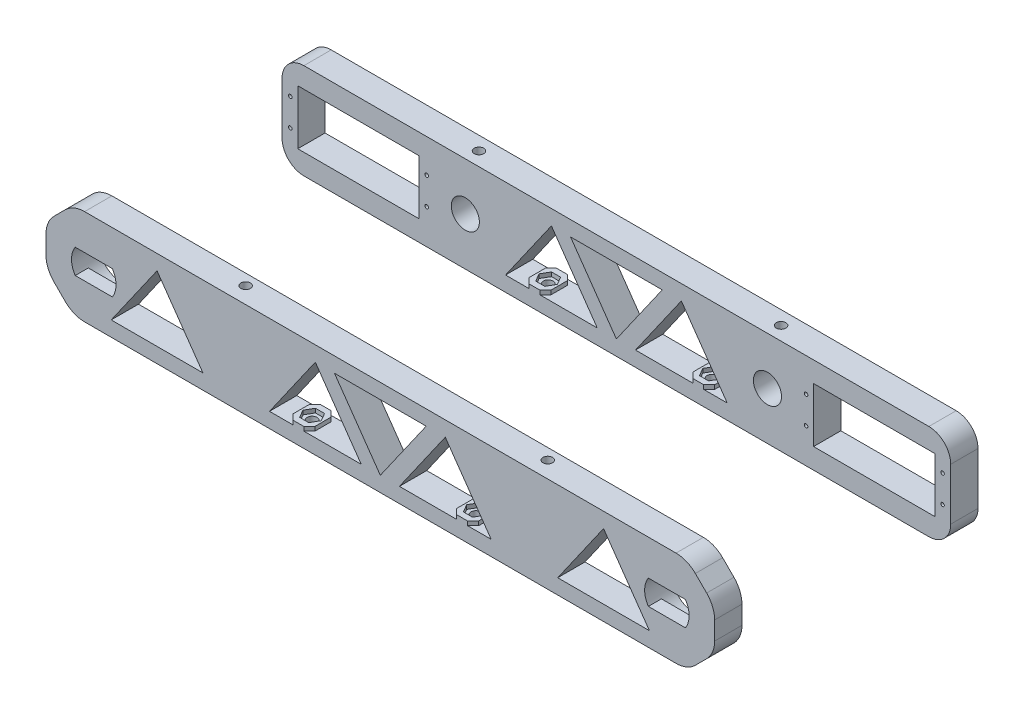
from build123d import *

# Parameters (mm, degrees)
SKETCH1_W           = 245
SKETCH1_H           = 35
SKETCH1_R           = 5.15
BOSS_EXTRUDE1_DEPTH = 10
BOSS_EXTRUDE2_START = -2
SKETCH2_R           = 5.15
BOSS_EXTRUDE2_DEPTH = 2
SKETCH3_W           = 245
SKETCH3_H           = 35
SKETCH3_R           = 0.65
SKETCH3_R_2         = 5.15
SKETCH3_W_2         = 44.5
SKETCH3_H_2         = 20
BOSS_EXTRUDE3_DEPTH = 10
SKETCH4_R           = 1.75
CUT_EXTRUDE1_DEPTH  = 10
CHAMFER1_SIZE       = 10
FILLET1_R           = 8
CUT_EXTRUDE3_DEPTH  = 10
SKETCH7_R           = 1.8
CUT_EXTRUDE4_DEPTH  = 10
SKETCH7_3_W         = 8
SKETCH7_3_H         = 10
BOSS_EXTRUDE4_DEPTH = 1.5
CHAMFER2_SIZE       = 2
CHAMFER3_SIZE       = 2
FILLET2_R           = 10
SKETCH1_3_R         = 8.15
CUT_EXTRUDE5_DEPTH  = 5.2
CUT_EXTRUDE6_DEPTH  = 263.168361936
SKETCH9_R           = 0.65
CUT_EXTRUDE7_DEPTH  = 5.2


with BuildPart() as part:
    # Sketch1 → Boss-Extrude1 (new body)
    with BuildSketch(Plane.XY):
        with Locations((-122.5, 17.5)):
            Rectangle(SKETCH1_W, SKETCH1_H)
        with Locations((-177.85, 17.5)):
            Circle(SKETCH1_R, mode=Mode.SUBTRACT)
        Polygon((-129.5, 5.5), (-163.109961834, 5.5), (-146.304980917, 29.5), align=None, mode=Mode.SUBTRACT)
        Polygon((-122.5, 5.5), (-139.304980917, 29.5), (-105.695019083, 29.5), align=None, mode=Mode.SUBTRACT)
        Polygon((-115.5, 5.5), (-98.695019083, 29.5), (-81.890038166, 5.5), align=None, mode=Mode.SUBTRACT)
        with Locations((-67.15, 17.5)):
            Circle(SKETCH1_R, mode=Mode.SUBTRACT)
    extrude(amount=BOSS_EXTRUDE1_DEPTH)

    # Sketch2 → Boss-Extrude2 (add)
    with BuildSketch(Plane.XY.offset(10).offset(BOSS_EXTRUDE2_START)):
        with Locations((-67.15, 17.5)):
            Circle(SKETCH2_R)
        with Locations((-177.85, 17.5)):
            Circle(SKETCH2_R)
    extrude(amount=BOSS_EXTRUDE2_DEPTH)


with BuildPart() as body_2:
    # Sketch3 → Boss-Extrude3 (new body)
    with BuildSketch(Plane.XY.offset(-76.5)):
        with Locations((-122.5, 17.5)):
            Rectangle(SKETCH3_W, SKETCH3_H)
        with Locations((-192, 12.728163815)):
            Circle(SKETCH3_R, mode=Mode.SUBTRACT)
        with Locations((-192, 22.728163815)):
            Circle(SKETCH3_R, mode=Mode.SUBTRACT)
        with Locations((-242, 12.728163815)):
            Circle(SKETCH3_R, mode=Mode.SUBTRACT)
        with Locations((-242, 22.728163815)):
            Circle(SKETCH3_R, mode=Mode.SUBTRACT)
        with Locations((-177.85, 17.5)):
            Circle(SKETCH3_R_2, mode=Mode.SUBTRACT)
        with Locations((-3, 22.728163815)):
            Circle(SKETCH3_R, mode=Mode.SUBTRACT)
        with Locations((-3, 12.728163815)):
            Circle(SKETCH3_R, mode=Mode.SUBTRACT)
        with Locations((-53, 12.728163815)):
            Circle(SKETCH3_R, mode=Mode.SUBTRACT)
        with Locations((-53, 22.728163815)):
            Circle(SKETCH3_R, mode=Mode.SUBTRACT)
        with Locations((-67.15, 17.5)):
            Circle(SKETCH3_R_2, mode=Mode.SUBTRACT)
        with Locations((-217, 17.5)):
            Rectangle(SKETCH3_W_2, SKETCH3_H_2, mode=Mode.SUBTRACT)
        with Locations((-28, 17.5)):
            Rectangle(SKETCH3_W_2, SKETCH3_H_2, mode=Mode.SUBTRACT)
        Polygon((-98.695019083, 29.5), (-115.5, 5.5), (-81.890038166, 5.5), align=None, mode=Mode.SUBTRACT)
        Polygon((-122.5, 5.5), (-105.695019083, 29.5), (-139.304980917, 29.5), align=None, mode=Mode.SUBTRACT)
        Polygon((-129.5, 5.5), (-163.109961834, 5.5), (-146.304980917, 29.5), align=None, mode=Mode.SUBTRACT)
    extrude(amount=-BOSS_EXTRUDE3_DEPTH)


with BuildPart() as cut_extrude1_tool:
    # Sketch4 → Cut-Extrude1 (new body)
    with BuildSketch(Plane(origin=(0, 35, 0), x_dir=(1, 0, 0), z_dir=(0, 1, 0))):
        with Locations((-177.85, -4)):
            Circle(SKETCH4_R)
        with Locations((-67.15, -4)):
            Circle(SKETCH4_R)
        with Locations((-177.85, 81.5)):
            Circle(SKETCH4_R)
        with Locations((-67.15, 81.5)):
            Circle(SKETCH4_R)
    extrude(amount=-CUT_EXTRUDE1_DEPTH)


with BuildPart() as part_1:
    add(part.part)

    # Cut-Extrude1: cut by cut_extrude1_tool
    add(cut_extrude1_tool.part, mode=Mode.SUBTRACT)

    # Chamfer1
    chamfer1_edges = [part_1.edges().sort_by_distance(p)[0] for p in [
        (0, 35, 5),
        (0, 0, 5),
        (-245, 0, 5),
        (-245, 35, 5),
    ]]
    chamfer(chamfer1_edges, length=CHAMFER1_SIZE)

    # Sketch6 → Cut-Extrude3 (cut)
    with BuildSketch(Plane.XY.offset(10)):
        Polygon((-221.109961834, 5.5), (-187.5, 5.5), (-204.304980917, 29.5), align=None)
        Polygon((-40.695019083, 29.5), (-57.5, 5.5), (-23.890038166, 5.5), align=None)
    extrude(amount=-CUT_EXTRUDE3_DEPTH, mode=Mode.SUBTRACT)


with BuildPart() as body_2_1:
    add(body_2.part)

    # Cut-Extrude1: cut by cut_extrude1_tool
    add(cut_extrude1_tool.part, mode=Mode.SUBTRACT)

    # Fillet1
    fillet1_edges = [body_2_1.edges().sort_by_distance(p)[0] for p in [
        (0, 0, -81.5),
        (0, 35, -81.5),
        (-245, 0, -81.5),
        (-245, 35, -81.5),
    ]]
    fillet(fillet1_edges, radius=FILLET1_R)


with BuildPart() as cut_extrude4_tool:
    # Sketch7 → Cut-Extrude4 (new body)
    with BuildSketch(Plane(origin=(0, 5.5, 0), x_dir=(1, 0, 0), z_dir=(0, 1, 0))):
        with Locations((-152.5, 81.5)):
            Circle(SKETCH7_R)
        with Locations((-92.5, 81.5)):
            Circle(SKETCH7_R)
        with Locations((-92.5, -5)):
            Circle(SKETCH7_R)
        with Locations((-152.5, -5)):
            Circle(SKETCH7_R)
    extrude(amount=-CUT_EXTRUDE4_DEPTH)


with BuildPart() as part_2:
    add(part_1.part)

    # Cut-Extrude4: cut by cut_extrude4_tool
    add(cut_extrude4_tool.part, mode=Mode.SUBTRACT)



with BuildPart() as body_2_2:
    add(body_2_1.part)

    # Cut-Extrude4: cut by cut_extrude4_tool
    add(cut_extrude4_tool.part, mode=Mode.SUBTRACT)


with BuildPart() as part_3:
    add(part_2.part)

    add(body_2_2.part)  # Boss-Extrude4 merges body 2
    # Sketch7<3> → Boss-Extrude4 (add)
    # profile 1 of 4: a face of its own
    with BuildSketch(Plane(origin=(0, 5.5, 0), x_dir=(1, 0, 0), z_dir=(0, 1, 0))):
        with Locations((-152.5, 81.5)):
            Rectangle(SKETCH7_3_W, SKETCH7_3_H)
        Polygon((-154.174315781, 78.6), (-155.848631561, 81.5), (-154.174315781, 84.4), (-150.825684219, 84.4), (-149.151368439, 81.5), (-150.825684219, 78.6), align=None, mode=Mode.SUBTRACT)
    # profile 2 of 4: a face of its own
    with BuildSketch(Plane(origin=(0, 5.5, 0), x_dir=(1, 0, 0), z_dir=(0, 1, 0))):
        with Locations((-92.5, 81.5)):
            Rectangle(SKETCH7_3_W, SKETCH7_3_H)
        Polygon((-89.151368439, 81.5), (-90.825684219, 78.6), (-94.174315781, 78.6), (-95.848631561, 81.5), (-94.174315781, 84.4), (-90.825684219, 84.4), align=None, mode=Mode.SUBTRACT)
    # profile 3 of 4: a face of its own
    with BuildSketch(Plane(origin=(0, 5.5, 0), x_dir=(1, 0, 0), z_dir=(0, 1, 0))):
        with Locations((-92.5, -5)):
            Rectangle(SKETCH7_3_W, SKETCH7_3_H)
        Polygon((-95.848631561, -5), (-94.174315781, -2.1), (-90.825684219, -2.1), (-89.151368439, -5), (-90.825684219, -7.9), (-94.174315781, -7.9), align=None, mode=Mode.SUBTRACT)
    # profile 4 of 4: a face of its own
    with BuildSketch(Plane(origin=(0, 5.5, 0), x_dir=(1, 0, 0), z_dir=(0, 1, 0))):
        with Locations((-152.5, -5)):
            Rectangle(SKETCH7_3_W, SKETCH7_3_H)
        Polygon((-154.174315781, -2.1), (-150.825684219, -2.1), (-149.151368439, -5), (-150.825684219, -7.9), (-154.174315781, -7.9), (-155.848631561, -5), align=None, mode=Mode.SUBTRACT)
    extrude(amount=BOSS_EXTRUDE4_DEPTH)

    # Chamfer2
    chamfer2_edges = [part_3.edges().sort_by_distance(p)[0] for p in [
        (-96.5, 6.25, -76.5),
        (-88.5, 6.25, -76.5),
        (-88.5, 6.25, -86.5),
        (-96.5, 6.25, -86.5),
        (-148.5, 6.25, -86.5),
        (-156.5, 6.25, -86.5),
        (-148.5, 6.25, -76.5),
        (-156.5, 6.25, -76.5),
    ]]
    chamfer(chamfer2_edges, length=CHAMFER2_SIZE)

    # Chamfer3
    chamfer3_edges = [part_3.edges().sort_by_distance(p)[0] for p in [
        (-88.5, 6.25, 0),
        (-88.5, 6.25, 10),
        (-96.5, 6.25, 10),
        (-96.5, 6.25, 0),
        (-148.5, 6.25, 0),
        (-148.5, 6.25, 10),
        (-156.5, 6.25, 10),
        (-156.5, 6.25, 0),
    ]]
    chamfer(chamfer3_edges, length=CHAMFER3_SIZE)

    # Fillet2
    fillet2_edges = [part_3.edges().sort_by_distance(p)[0] for p in [
        (-10, 35, 5),
        (-10, 0, 5),
        (0, 10, 5),
        (0, 25, 5),
        (-235, 0, 5),
        (-245, 10, 5),
        (-245, 25, 5),
        (-235, 35, 5),
    ]]
    fillet(fillet2_edges, radius=FILLET2_R)

    # Sketch1<3> → Cut-Extrude5 (cut)
    with BuildSketch(Plane.XY):
        with Locations((-227.5, 17.5)):
            Circle(SKETCH1_3_R)
        with Locations((-17.5, 17.5)):
            Circle(SKETCH1_3_R)
    extrude(amount=CUT_EXTRUDE5_DEPTH, mode=Mode.SUBTRACT)

    # Sketch8 → Cut-Extrude6 (cut, through all)
    with BuildSketch(Plane(origin=(0, 0, 0), x_dir=(-1, 0, 0), z_dir=(0, 0, -1))):
        with BuildLine():
            Line((10.704965048, 22), (24.295034952, 22))
            ThreePointArc((24.295034952, 22), (25.65, 17.5), (24.295034952, 13))
            Line((24.295034952, 13), (10.704965048, 13))
            ThreePointArc((10.704965048, 13), (9.35, 17.5), (10.704965048, 22))
        make_face()
        with BuildLine():
            Line((220.704965048, 22), (234.295034952, 22))
            ThreePointArc((234.295034952, 22), (235.65, 17.5), (234.295034952, 13))
            Line((234.295034952, 13), (220.704965048, 13))
            ThreePointArc((220.704965048, 13), (219.35, 17.5), (220.704965048, 22))
        make_face()
    extrude(amount=-CUT_EXTRUDE6_DEPTH, mode=Mode.SUBTRACT)

    # Sketch9 → Cut-Extrude7 (cut)
    with BuildSketch(Plane(origin=(0, 25, 0), x_dir=(1, 0, 0), z_dir=(0, 1, 0))):
        with Locations((-177.85, -4)):
            Circle(SKETCH9_R)
        with Locations((-67.15, -4)):
            Circle(SKETCH9_R)
        with Locations((-67.15, 81.5)):
            Circle(SKETCH9_R)
        with Locations((-177.85, 81.5)):
            Circle(SKETCH9_R)
    extrude(amount=-CUT_EXTRUDE7_DEPTH, mode=Mode.SUBTRACT)


solid = part_3.part
